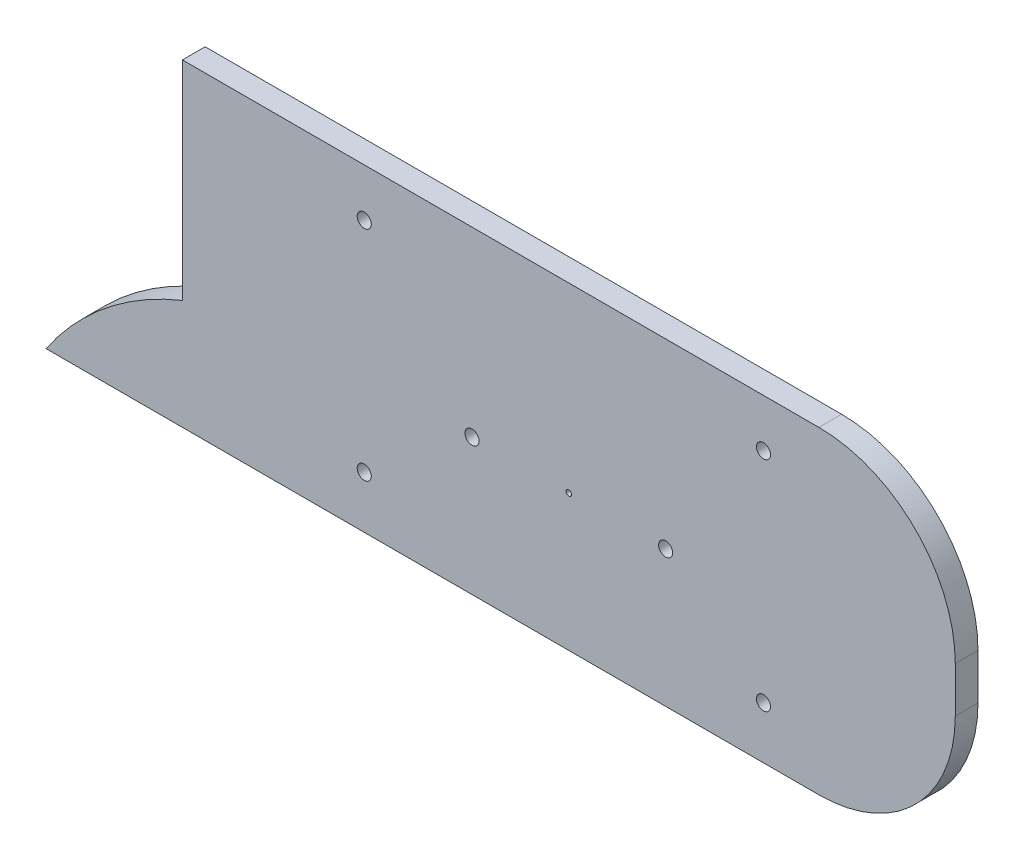
from build123d import *

# Parameters (mm, degrees)
BOSS_EXTRUDE1_DEPTH = 12.7
SKETCH3_R           = 3.937
CUT_EXTRUDE1_DEPTH  = 539.366167213
SKETCH4_R           = 1.524
SKETCH4_R_2         = 3.937
CUT_EXTRUDE2_DEPTH  = 539.366167213


with BuildPart() as part:
    # Sketch2 → Boss-Extrude1 (new body)
    with BuildSketch(Plane.XY):
        with BuildLine():
            Line((0, 0), (431.8, 0))
            ThreePointArc((431.8, 0), (485.681536726, 22.318463274), (508, 76.2))
            Line((508, 76.2), (508, 101.6))
            ThreePointArc((508, 101.6), (485.681536726, 155.481536726), (431.8, 177.8))
            Line((431.8, 177.8), (152.4, 177.8))
            Line((152.4, 177.8), (76.2, 177.8))
            Line((76.2, 177.8), (76.2, 61.401251199))
            ThreePointArc((76.2, 61.401251199), (33.506060073, 36.401783403), (0, 0))
        make_face()
    extrude(amount=BOSS_EXTRUDE1_DEPTH)

    # Sketch3 → Cut-Extrude1 (cut, through all)
    with BuildSketch(Plane(origin=(0, 0, 0), x_dir=(-1, 0, 0), z_dir=(0, 0, -1))):
        with Locations((-177.8, 29.082055279)):
            Circle(SKETCH3_R)
        with Locations((-400.836394982, 29.082055279)):
            Circle(SKETCH3_R)
        with Locations((-400.836394982, 151.002055279)):
            Circle(SKETCH3_R)
        with Locations((-177.8, 151.002055279)):
            Circle(SKETCH3_R)
    extrude(amount=-CUT_EXTRUDE1_DEPTH, mode=Mode.SUBTRACT)

    # Sketch4 → Cut-Extrude2 (cut, through all)
    with BuildSketch(Plane.XY.offset(12.7)):
        with Locations((292.1, 76.2)):
            Circle(SKETCH4_R)
        with Locations((237.998, 76.2)):
            Circle(SKETCH4_R_2)
        with Locations((346.202, 76.2)):
            Circle(SKETCH4_R_2)
    extrude(amount=-CUT_EXTRUDE2_DEPTH, mode=Mode.SUBTRACT)


solid = part.part
